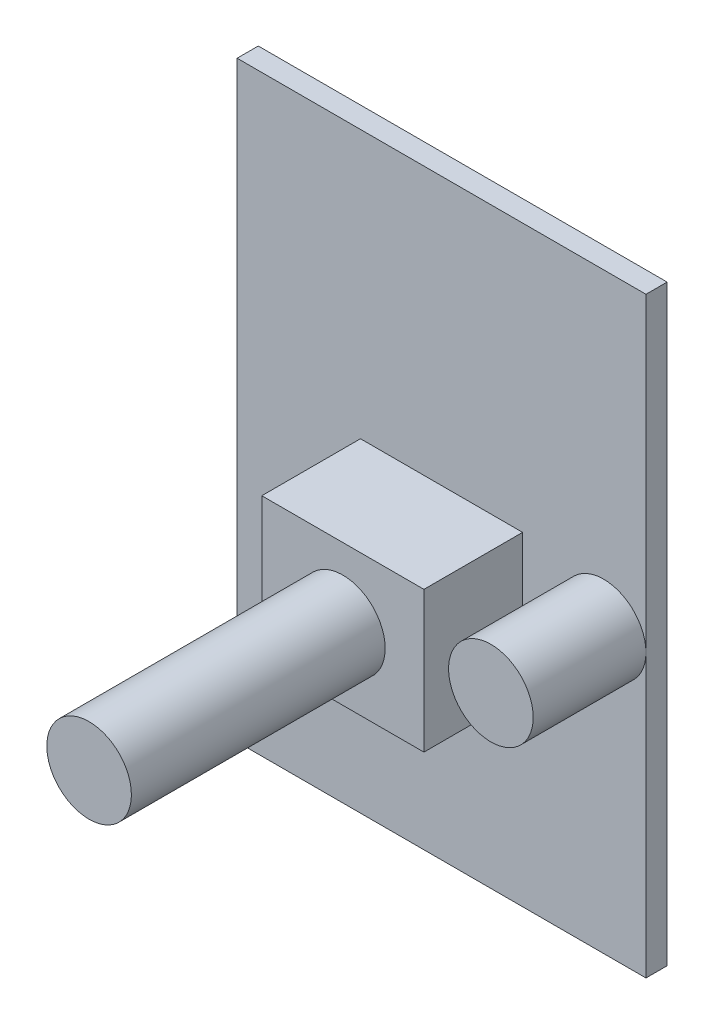
from build123d import *

# Parameters (mm, degrees)
SKETCH1_W           = 29
SKETCH1_H           = 42
BOSS_EXTRUDE1_DEPTH = 1.5
SKETCH2_W           = 11.5
SKETCH2_H           = 10
BOSS_EXTRUDE2_DEPTH = 7
SKETCH3_R           = 3
BOSS_EXTRUDE3_DEPTH = 18
SKETCH4_R           = 3
BOSS_EXTRUDE4_DEPTH = 8


with BuildPart() as part:
    # Sketch1 → Boss-Extrude1 (new body)
    with BuildSketch(Plane.XY):
        Rectangle(SKETCH1_W, SKETCH1_H)
    extrude(amount=BOSS_EXTRUDE1_DEPTH)

    # Sketch2 → Boss-Extrude2 (add)
    with BuildSketch(Plane.XY.offset(1.5)):
        with Locations((0, -3)):
            Rectangle(SKETCH2_W, SKETCH2_H)
    extrude(amount=BOSS_EXTRUDE2_DEPTH)

    # Sketch3 → Boss-Extrude3 (add)
    with BuildSketch(Plane.XY.offset(8.5)):
        with Locations((0, -3)):
            Circle(SKETCH3_R)
    extrude(amount=BOSS_EXTRUDE3_DEPTH)

    # Sketch4 → Boss-Extrude4 (add)
    with BuildSketch(Plane.XY.offset(1.5)):
        with Locations((11.5, -1)):
            Circle(SKETCH4_R)
    extrude(amount=BOSS_EXTRUDE4_DEPTH)


solid = part.part
